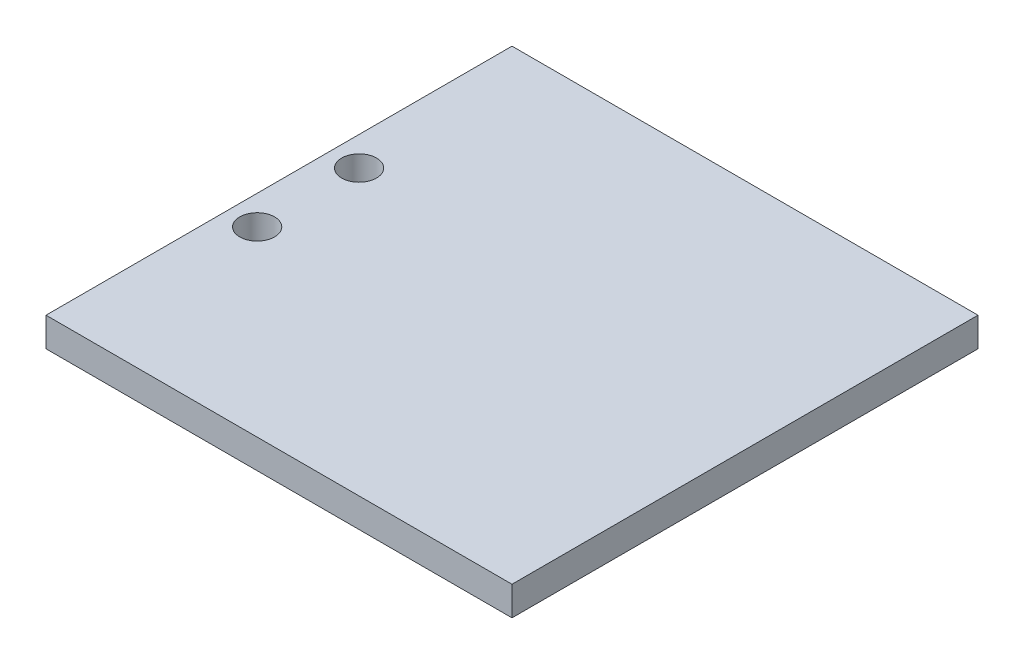
from build123d import *

# Parameters (mm, degrees)
SKETCH1_W                 = 50.8
SKETCH1_H                 = 50.8
BOSS_EXTRUDE1_DEPTH       = 3.175
F_6_CLEARANCE_HOLE1_D     = 3.7973
F_6_CLEARANCE_HOLE1_DEPTH = 12.7
F_6_CLEARANCE_HOLE1_TIP   = 1.140824014


with BuildPart() as part:
    # Sketch1 → Boss-Extrude1 (new body)
    with BuildSketch(Plane(origin=(0, 0, 0), x_dir=(1, 0, 0), z_dir=(0, 1, 0))):
        Rectangle(SKETCH1_W, SKETCH1_H)
    extrude(amount=BOSS_EXTRUDE1_DEPTH)

    # #6 Clearance Hole1
    with Locations(Plane(origin=(0, 3.175, 0), x_dir=(1, 0, 0), z_dir=(0, 1, 0))):
        with Locations((-22.225, 5.55625), (-22.225, -5.55625)):
            Hole(F_6_CLEARANCE_HOLE1_D / 2, depth=F_6_CLEARANCE_HOLE1_DEPTH)
            with Locations((0, 0, -(F_6_CLEARANCE_HOLE1_DEPTH + F_6_CLEARANCE_HOLE1_TIP / 2))):  # 118° drill point
                Cone(0, F_6_CLEARANCE_HOLE1_D / 2, F_6_CLEARANCE_HOLE1_TIP, mode=Mode.SUBTRACT)


solid = part.part
